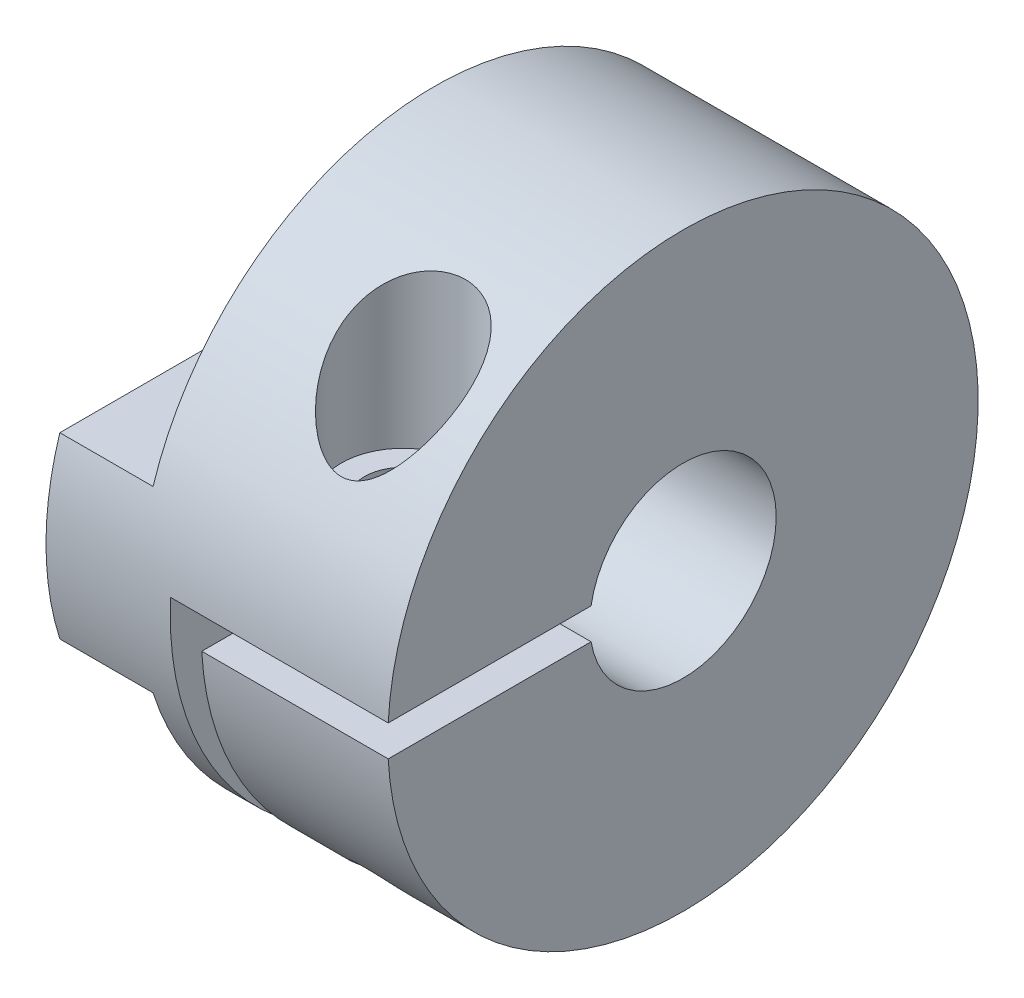
from build123d import *

# Parameters (mm, degrees)
ESQUISSE2_W                  = 3
ESQUISSE2_H                  = 6.625
ENL_V_MAT_EXTRU_1_DEPTH      = 10
ESQUISSE3_W                  = 1
ESQUISSE3_H                  = 19
ENL_V_MAT_EXTRU_2_DEPTH      = 18.363755354
ESQUISSE4_W                  = 9.5
ESQUISSE4_H                  = 1
ENL_V_MAT_EXTRU_3_DEPTH      = 7
ESQUISSE5_R                  = 1.25
ENL_V_MAT_EXTRU_4_DEPTH      = 10
ENL_V_MAT_EXTRU_6_REACH      = 21.5
ENL_V_MAT_EXTRU_6_END_RADIUS = 9.5
ESQUISSE7_R                  = 2


with BuildPart() as part:
    # Esquisse1 → Base-Révolution (revolve)
    with BuildSketch(Plane.XY, mode=Mode.PRIVATE) as base_r_volution_sk:
        Polygon((0, 1.5), (0, 9.5), (11, 9.5), (11, 3), (4, 3), (4, 1.5), align=None)
    revolve(base_r_volution_sk.sketch.rotate(Axis((0, 0, 0), (1, 0, 0)), 90), axis=Axis((0, 0, 0), (1, 0, 0)))

    # Esquisse2 → Enlèv. mat.-Extru.1 (cut, symmetric)
    with BuildSketch(Plane.XY):
        with Locations((1.5, 6.1875)):
            Rectangle(ESQUISSE2_W, ESQUISSE2_H)
        with Locations((1.5, -6.1875)):
            Rectangle(ESQUISSE2_W, ESQUISSE2_H)
    extrude(amount=ENL_V_MAT_EXTRU_1_DEPTH, both=True, mode=Mode.SUBTRACT)

    # Esquisse3 → Enlèv. mat.-Extru.2 (cut, through all)
    with BuildSketch(Plane(origin=(0, 0, 0), x_dir=(1, 0, 0), z_dir=(0, 1, 0))):
        with Locations((4.5, 0)):
            Rectangle(ESQUISSE3_W, ESQUISSE3_H)
    extrude(amount=-ENL_V_MAT_EXTRU_2_DEPTH, mode=Mode.SUBTRACT)

    # Esquisse4 → Enlèv. mat.-Extru.3 (cut)
    with BuildSketch(Plane(origin=(11, 0, 0), x_dir=(0, 0, -1), z_dir=(1, 0, 0))):
        with Locations((-4.75, 0)):
            Rectangle(ESQUISSE4_W, ESQUISSE4_H)
    extrude(amount=-ENL_V_MAT_EXTRU_3_DEPTH, mode=Mode.SUBTRACT)

    # Esquisse5 → Enlèv. mat.-Extru.4 (cut, symmetric)
    with BuildSketch(Plane(origin=(0, 0, 0), x_dir=(1, 0, 0), z_dir=(0, 1, 0))):
        with Locations(Location((8, -6, 0), (0, 0, 270))):
            Circle(ESQUISSE5_R)
    extrude(amount=ENL_V_MAT_EXTRU_4_DEPTH, both=True, mode=Mode.SUBTRACT)

    # Enlèv. mat.-Extru.6: up to this cylinder (the profile starts inside it)
    enl_v_mat_extru_6_end = Plane(origin=(8, 0, 0), z_dir=(-1, 0, 0)) * Cylinder(ENL_V_MAT_EXTRU_6_END_RADIUS, 63, mode=Mode.PRIVATE)
    # Esquisse7 → Enlèv. mat.-Extru.6 (cut, up to the surface)
    with BuildSketch(Plane.XZ.offset(-3.5), mode=Mode.PRIVATE) as enl_v_mat_extru_6_sk1:
        with Locations(Location((8, 6, 0), (0, 0, 270))):
            Circle(ESQUISSE7_R)
    enl_v_mat_extru_6_tool1 = extrude(enl_v_mat_extru_6_sk1.sketch, amount=-ENL_V_MAT_EXTRU_6_REACH, mode=Mode.PRIVATE) & enl_v_mat_extru_6_end
    add(enl_v_mat_extru_6_tool1.solids().sort_by_distance((8, 3.5, 6))[0], mode=Mode.SUBTRACT)


solid = part.part
